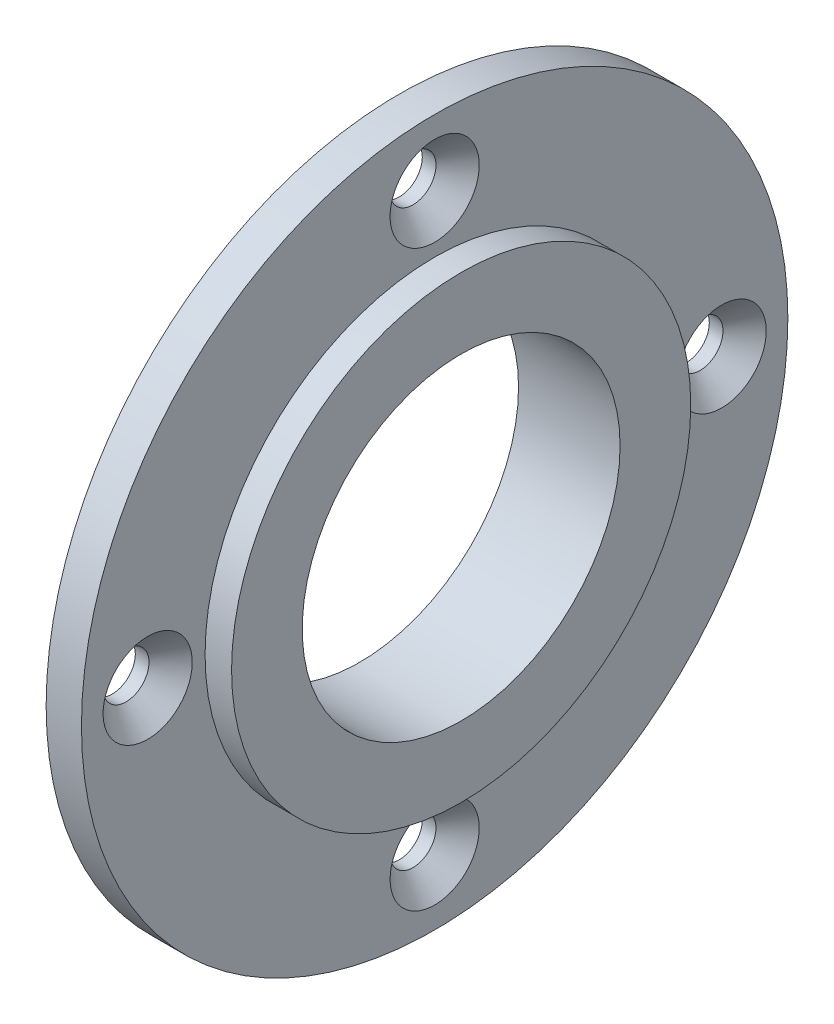
from build123d import *

# Parameters (mm, degrees)
CSK_FOR_M5_COUNTERSUNK_FLAT_HEAD_SCREW1_D           = 5.2
CSK_FOR_M5_COUNTERSUNK_FLAT_HEAD_SCREW1_CSINK_D     = 10.1
CSK_FOR_M5_COUNTERSUNK_FLAT_HEAD_SCREW1_CSINK_ANGLE = 90
CIRPATTERN1_COUNT                                   = 4


with BuildPart() as part:
    # Sketch2 → Revolve1 (revolve)
    with BuildSketch(Plane.XY, mode=Mode.PRIVATE) as revolve1_sk:
        Polygon((-174.905599099, 26), (-177.905599099, 26), (-177.905599099, 40), (-181.905599099, 40), (-181.905599099, 21), (-186.405599099, 21), (-186.405599099, 18), (-174.905599099, 18), align=None)
    revolve(revolve1_sk.sketch.rotate(Axis((0, 0, 0), (-1, 0, 0)), 90), axis=Axis((0, 0, 0), (-1, 0, 0)))

    # CSK for M5 Countersunk Flat Head Screw1 (through all)
    with Locations(Plane(origin=(-177.905599099, 0, 0), x_dir=(0, 0, -1), z_dir=(1, 0, 0))):
        with Locations((0, 32.5)):
            csk_for_m5_countersunk_flat_head_screw1 = CounterSinkHole(CSK_FOR_M5_COUNTERSUNK_FLAT_HEAD_SCREW1_D / 2, CSK_FOR_M5_COUNTERSUNK_FLAT_HEAD_SCREW1_CSINK_D / 2, counter_sink_angle=CSK_FOR_M5_COUNTERSUNK_FLAT_HEAD_SCREW1_CSINK_ANGLE)

    # CirPattern1: CSK for M5 Countersunk Flat Head Screw1 ×4 about axis
    cirpattern1_axis = Axis((0, 0, 0), (1, 0, 0))
    for i in range(1, CIRPATTERN1_COUNT):
        add(csk_for_m5_countersunk_flat_head_screw1.rotate(cirpattern1_axis, i * 360 / CIRPATTERN1_COUNT), mode=Mode.SUBTRACT)


solid = part.part
